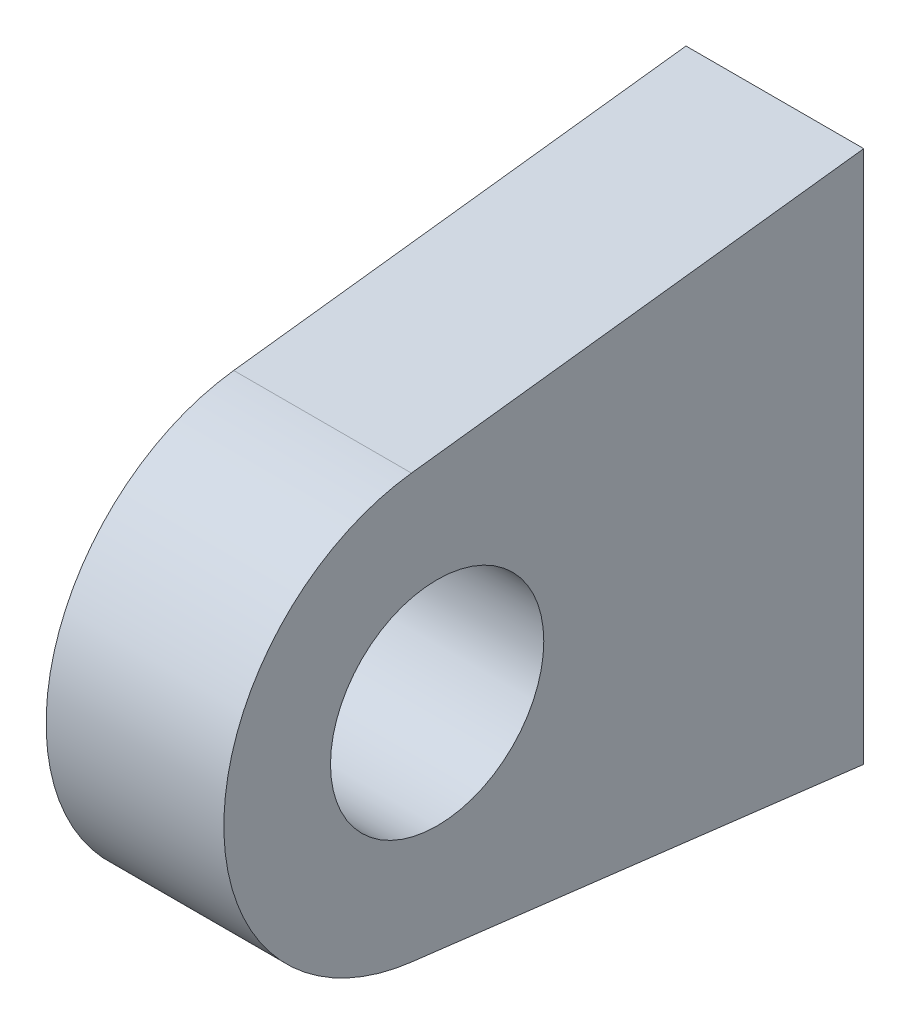
from build123d import *

# Parameters (mm, degrees)
SKETCH1_R           = 3
BOSS_EXTRUDE2_DEPTH = 2.5


with BuildPart() as part:
    # Sketch1 → Boss-Extrude2 (new, symmetric)
    with BuildSketch(Plane.YZ):
        with BuildLine():
            Line((7.5, 0), (-7.5, 0))
            Line((-7.5, 0), (-5.956316627, 12.722697892))
            ThreePointArc((-5.956316627, 12.722697892), (0, 18), (5.956316627, 12.722697892))
            Line((5.956316627, 12.722697892), (7.5, 0))
        make_face()
        with Locations(Location((0, 12, 0), (0, 0, 270))):
            Circle(SKETCH1_R, mode=Mode.SUBTRACT)
    extrude(amount=BOSS_EXTRUDE2_DEPTH, both=True)


solid = part.part
